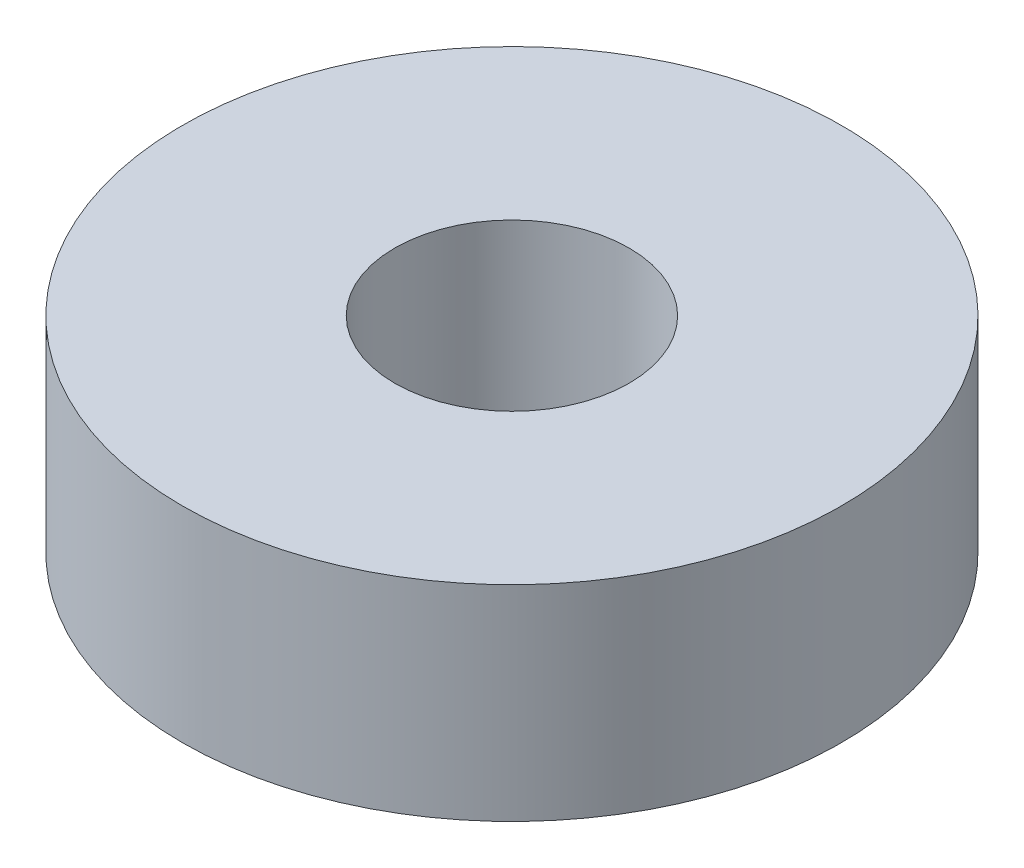
from build123d import *

# Parameters (mm, degrees)
SKETCH1_R           = 11.25
BOSS_EXTRUDE1_DEPTH = 7
SKETCH2_R           = 4
CUT_EXTRUDE1_DEPTH  = 7


with BuildPart() as part:
    # Sketch1 → Boss-Extrude1 (new body)
    with BuildSketch(Plane(origin=(0, 0, 0), x_dir=(1, 0, 0), z_dir=(0, 1, 0))):
        Circle(SKETCH1_R)
    extrude(amount=BOSS_EXTRUDE1_DEPTH)

    # Sketch2 → Cut-Extrude1 (cut)
    with BuildSketch(Plane(origin=(0, 7, 0), x_dir=(1, 0, 0), z_dir=(0, 1, 0))):
        Circle(SKETCH2_R)
    extrude(amount=-CUT_EXTRUDE1_DEPTH, mode=Mode.SUBTRACT)


solid = part.part
